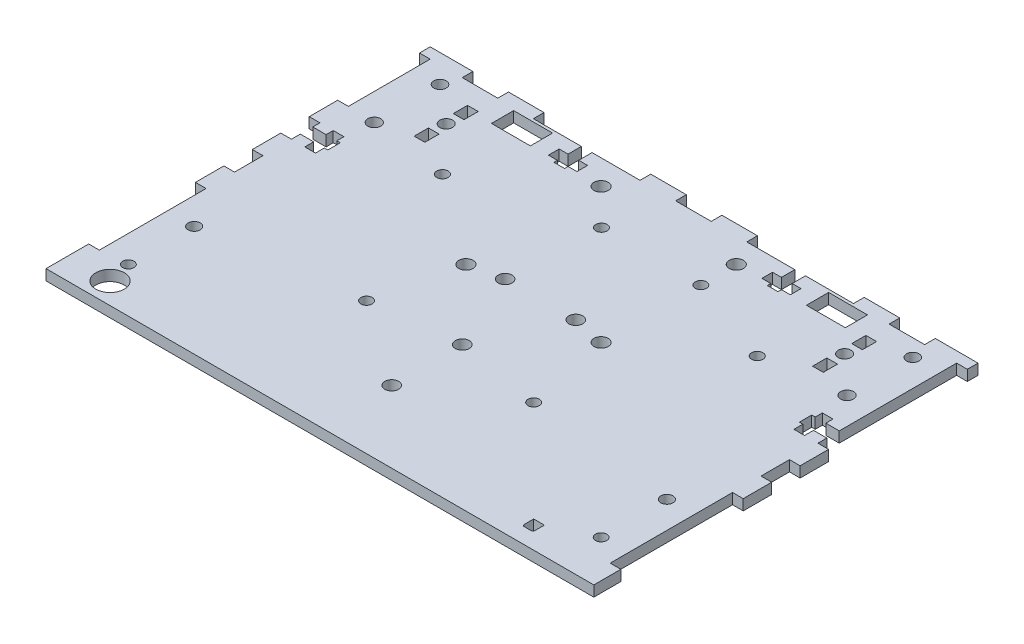
from build123d import *

# Parameters (mm, degrees)
CROQUIS1_R              = 4
SALIENTE_EXTRUIR1_DEPTH = 1.497272789
CROQUIS12_W             = 3
CROQUIS12_H             = 23
CROQUIS12_H_2           = 8
CROQUIS12_H_3           = 18.4
CROQUIS12_H_4           = 9
CORTAR_EXTRUIR10_DEPTH  = 10
CROQUIS13_W             = 3
CROQUIS13_H             = 8
CORTAR_EXTRUIR11_DEPTH  = 10
CROQUIS15_R             = 1.5875
CORTAR_EXTRUIR13_DEPTH  = 10
CROQUIS18_R             = 1.705288108
CROQUIS18_R_2           = 1.572259227
CROQUIS18_R_3           = 1.751719864
CROQUIS18_R_4           = 1.822918829
CORTAR_EXTRUIR15_DEPTH  = 10
CROQUIS19_R             = 1.8
CROQUIS19_W             = 3
CROQUIS19_H             = 4
CORTAR_EXTRUIR16_DEPTH  = 10
CROQUIS20_R             = 1.600000002
CROQUIS20_W             = 10.939065956
CROQUIS20_H             = 6.243980126
CORTAR_EXTRUIR17_DEPTH  = 10
CROQUIS21_R             = 1.951923789
CROQUIS21_R_2           = 2
CORTAR_EXTRUIR18_DEPTH  = 10
CROQUIS22_R             = 1.951923789
CORTAR_EXTRUIR19_DEPTH  = 10


with BuildPart() as part:
    # Croquis1 → Saliente-Extruir1 (new, symmetric)
    with BuildSketch(Plane(origin=(0, 0, 0), x_dir=(1, 0, 0), z_dir=(0, 1, 0))):
        Polygon((-77, -42), (-77, -54), (77, -54), (77, -42), (74, -42), (74, -28), (77, -28), (77, -20), (74, -20), (74, -12), (77, -12), (77, -4), (74, -4), (74, -1.5), (74, 1.5), (74, 4), (77, 4), (77, 12), (74, 12), (74, 14.497912952), (70.25, 14.497912952), (70.25, 12), (67.25, 12), (67.25, 14.497912952), (66.27, 14.497912952), (66.27, 17.992083938), (67.25, 17.992083938), (67.25, 20), (70.25, 20), (70.25, 17.992083938), (74, 17.992083938), (74, 20), (77, 20), (77, 28), (74, 28), (74, 42), (77, 42), (77, 54), (65, 54), (65, 51), (55, 51), (55, 54), (45, 54), (45, 51), (31.5, 51), (31.5, 47.25), (34, 47.25), (34, 44.25), (31.5, 44.25), (31.5, 43.27), (28.5, 43.27), (28.5, 44.25), (26, 44.25), (26, 47.25), (28.5, 47.25), (28.5, 51), (15, 51), (15, 54), (5, 54), (5, 51), (-5, 51), (-5, 54), (-15, 54), (-15, 51), (-28.5, 51), (-28.5, 47.25), (-26, 47.25), (-26, 44.25), (-28.5, 44.25), (-28.5, 43.27), (-31.5, 43.27), (-31.5, 44.25), (-34, 44.25), (-34, 47.25), (-31.5, 47.25), (-31.5, 51), (-45, 51), (-45, 54), (-55, 54), (-55, 51), (-65, 51), (-65, 54), (-77, 54), (-77, 42), (-74, 42), (-74, 28), (-77, 28), (-77, 20), (-74, 20), (-74, 17.992083938), (-70.25, 17.992083938), (-70.25, 20), (-67.25, 20), (-67.25, 17.992083938), (-66.27, 17.992083938), (-66.27, 14.497912952), (-67.25, 14.497912952), (-67.25, 12), (-70.25, 12), (-70.25, 14.497912952), (-74, 14.497912952), (-74, 12), (-77, 12), (-77, 4), (-74, 4), (-74, 1.5), (-74, -1.5), (-74, -4), (-77, -4), (-77, -12), (-74, -12), (-74, -20), (-77, -20), (-77, -28), (-74, -28), (-74, -42), align=None)
        with Locations(Location((-65, -48, 0), (0, 0, 270))):
            Circle(CROQUIS1_R, mode=Mode.SUBTRACT)
        with BuildLine():
            Line((55, -49.6), (53, -49.6))
            ThreePointArc((53, -49.6), (52.646446609, -49.453553391), (52.5, -49.1))
            Line((52.5, -49.1), (52.5, -46.4))
            Line((52.5, -46.4), (55.5, -46.4))
            Line((55.5, -46.4), (55.5, -49.1))
            ThreePointArc((55.5, -49.1), (55.353553391, -49.453553391), (55, -49.6))
        make_face(mode=Mode.SUBTRACT)
    extrude(amount=SALIENTE_EXTRUIR1_DEPTH, both=True)

    # Croquis12 → Cortar-Extruir10 (cut)
    with BuildSketch(Plane.XZ.offset(1.497272789)):
        with Locations((-75.5, -39.5)):
            Rectangle(CROQUIS12_W, CROQUIS12_H)
        with Locations((-75.5, 24)):
            Rectangle(CROQUIS12_W, CROQUIS12_H_2)
        with Locations((75.5, -24)):
            Rectangle(CROQUIS12_W, CROQUIS12_H_2)
        with Locations((75.5, 37.2)):
            Rectangle(CROQUIS12_W, CROQUIS12_H_3)
        with Locations((75.5, -46.5)):
            Rectangle(CROQUIS12_W, CROQUIS12_H_4)
    extrude(amount=-CORTAR_EXTRUIR10_DEPTH, mode=Mode.SUBTRACT)

    # Croquis13 → Cortar-Extruir11 (cut)
    with BuildSketch(Plane.XZ.offset(1.497272789)):
        with Locations((75.5, 24)):
            Rectangle(CROQUIS13_W, CROQUIS13_H)
    extrude(amount=-CORTAR_EXTRUIR11_DEPTH, mode=Mode.SUBTRACT)

    # Croquis15 → Cortar-Extruir13 (cut)
    with BuildSketch(Plane(origin=(0, 1.497272789, 0), x_dir=(1, 0, 0), z_dir=(0, 1, 0))):
        with Locations(Location((-8.89, 34.036119394, 0), (0, 0, 270))):
            Circle(CROQUIS15_R)
        with Locations(Location((19.05, 34.036119394, 0), (0, 0, 270))):
            Circle(CROQUIS15_R)
        with Locations(Location((24.13, -18.033880606, 0), (0, 0, 270))):
            Circle(CROQUIS15_R)
        with Locations(Location((-24.13, -16.763880606, 0), (0, 0, 270))):
            Circle(CROQUIS15_R)
    extrude(amount=-CORTAR_EXTRUIR13_DEPTH, mode=Mode.SUBTRACT)

    # Croquis18 → Cortar-Extruir15 (cut)
    with BuildSketch(Plane(origin=(0, 1.497272789, 0), x_dir=(1, 0, 0), z_dir=(0, 1, 0))):
        with Locations(Location((66.447956343, -22.895683893, 0), (0, 0, 270))):
            Circle(CROQUIS18_R)
        with Locations(Location((66.447956343, -41.396232491, 0), (0, 0, 270))):
            Circle(CROQUIS18_R_2)
        with Locations(Location((66.447956343, 46.216518088, 0), (0, 0, 270))):
            Circle(CROQUIS18_R_3)
        with Locations(Location((66.447956343, 27.741721108, 0), (0, 0, 270))):
            Circle(CROQUIS18_R_4)
        with Locations(Location((-66.447956343, 27.741721108, 0), (0, 0, 270))):
            Circle(CROQUIS18_R_4)
        with Locations(Location((-66.447956343, 46.216518088, 0), (0, 0, 270))):
            Circle(CROQUIS18_R_3)
        with Locations(Location((-66.447956343, -41.396232491, 0), (0, 0, 270))):
            Circle(CROQUIS18_R_2)
        with Locations(Location((-66.447956343, -22.895683893, 0), (0, 0, 270))):
            Circle(CROQUIS18_R)
    extrude(amount=-CORTAR_EXTRUIR15_DEPTH, mode=Mode.SUBTRACT)

    # Croquis19 → Cortar-Extruir16 (cut)
    with BuildSketch(Plane(origin=(0, 1.497272789, 0), x_dir=(1, 0, 0), z_dir=(0, 1, 0))):
        with Locations(Location((-56, 37.5, 0), (0, 0, 270))):
            Circle(CROQUIS19_R)
        with Locations(Location((56, 37.5, 0), (0, 0, 270))):
            Circle(CROQUIS19_R)
        with Locations((-56, 32)):
            Rectangle(CROQUIS19_W, CROQUIS19_H)
        with Locations((-56, 43)):
            Rectangle(CROQUIS19_W, CROQUIS19_H)
        with Locations((56, 43)):
            Rectangle(CROQUIS19_W, CROQUIS19_H)
        with Locations((56, 32)):
            Rectangle(CROQUIS19_W, CROQUIS19_H)
    extrude(amount=-CORTAR_EXTRUIR16_DEPTH, mode=Mode.SUBTRACT)

    # Croquis20 → Cortar-Extruir17 (cut)
    with BuildSketch(Plane(origin=(0, 1.497272789, 0), x_dir=(1, 0, 0), z_dir=(0, 1, 0))):
        with Locations(Location((-44.25, 24.7, 0), (0, 0, 270))):
            Circle(CROQUIS20_R)
        with Locations((-44.267144923, 47.081261314)):
            Rectangle(CROQUIS20_W, CROQUIS20_H)
    cortar_extruir17 = extrude(amount=-CORTAR_EXTRUIR17_DEPTH, mode=Mode.SUBTRACT)

    # Simetría1: Cortar-Extruir17 across plane
    add(cortar_extruir17.mirror(Plane(origin=(0, 0, 0), x_dir=(0, 0, 1), z_dir=(1, 0, 0))), mode=Mode.SUBTRACT)

    # Croquis21 → Cortar-Extruir18 (cut)
    with BuildSketch(Plane(origin=(0, 1.497272789, 0), x_dir=(1, 0, 0), z_dir=(0, 1, 0))):
        with Locations(Location((0, -33.825, 0), (0, 0, 270))):
            Circle(CROQUIS21_R)
        with Locations(Location((0, -13.975, 0), (0, 0, 270))):
            Circle(CROQUIS21_R)
        with Locations(Location((19, 6.05, 0), (0, 0, 270))):
            Circle(CROQUIS21_R_2)
        with Locations(Location((19, 44.05, 0), (0, 0, 270))):
            Circle(CROQUIS21_R_2)
        with Locations(Location((-19, 44.05, 0), (0, 0, 270))):
            Circle(CROQUIS21_R_2)
        with Locations(Location((-19, 6.05, 0), (0, 0, 270))):
            Circle(CROQUIS21_R_2)
    extrude(amount=-CORTAR_EXTRUIR18_DEPTH, mode=Mode.SUBTRACT)

    # Croquis22 → Cortar-Extruir19 (cut)
    with BuildSketch(Plane(origin=(0, 1.497272789, 0), x_dir=(1, 0, 0), z_dir=(0, 1, 0))):
        with Locations(Location((-9.925, 8, 0), (0, 0, 270))):
            Circle(CROQUIS22_R)
        with Locations(Location((9.925, 8, 0), (0, 0, 270))):
            Circle(CROQUIS22_R)
    extrude(amount=-CORTAR_EXTRUIR19_DEPTH, mode=Mode.SUBTRACT)


solid = part.part
